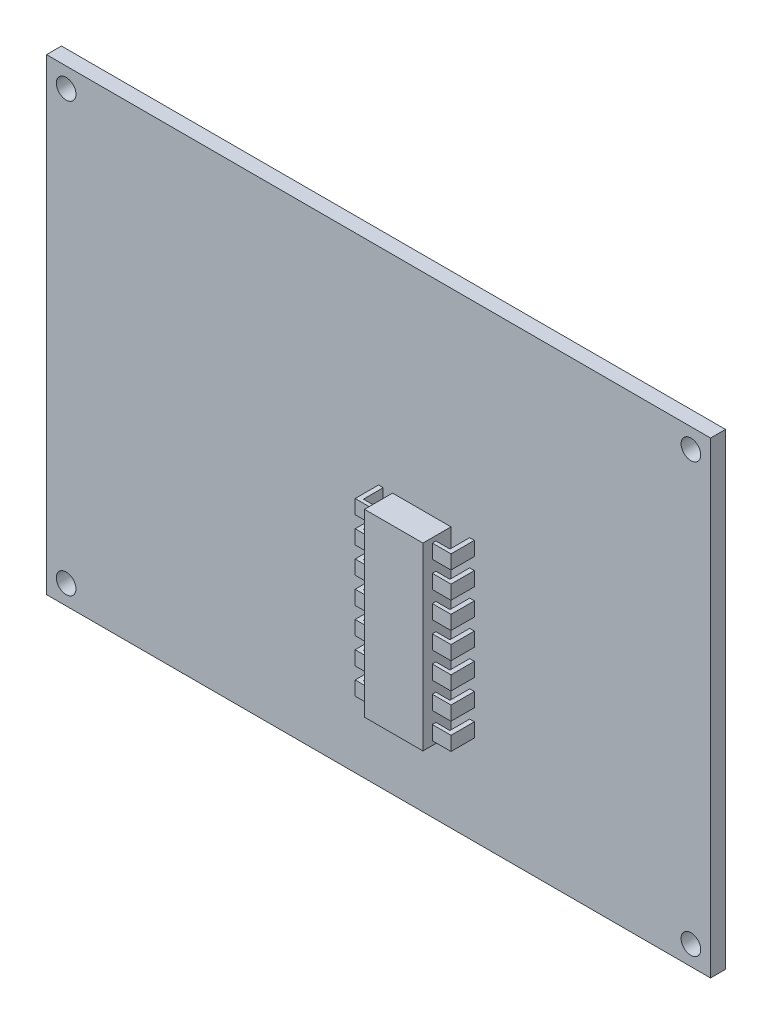
from build123d import *

# Parameters (mm, degrees)
SKETCH_1_W               = 71
SKETCH_1_H               = 50
SKETCH_1_R               = 1.05
EXTRUDE_1_DEPTH          = 1.6
SKETCH_2_W               = 6.25
SKETCH_2_H               = 19.25
EXTRUDE_2_DEPTH          = 3.5
EXTRUDE_START            = -1
SKETCH_4_W               = 2
SKETCH_4_H               = 1.5
EXTRUDE_3_DEPTH          = 2.5
CUT_EXTRUDE_1_DEPTH      = 83.071508455
CUT_EXTRUDE_1_DEPTH_BACK = 83.071508455


with BuildPart() as part:
    # Эскиз1 → Бобышка-Вытянуть1 (new body)
    with BuildSketch(Plane.XY):
        with Locations((35.5, 25)):
            Rectangle(SKETCH_1_W, SKETCH_1_H)
        with Locations((2.1, 47.9)):
            Circle(SKETCH_1_R, mode=Mode.SUBTRACT)
        with Locations(Location((68.9, 47.9, 0), (0, 0, 180))):
            Circle(SKETCH_1_R, mode=Mode.SUBTRACT)
        with Locations((68.9, 2.1)):
            Circle(SKETCH_1_R, mode=Mode.SUBTRACT)
        with Locations(Location((2.1, 2.1, 0), (0, 0, 180))):
            Circle(SKETCH_1_R, mode=Mode.SUBTRACT)
    extrude(amount=EXTRUDE_1_DEPTH)

    # Эскиз2 → Бобышка-Вытянуть2 (add)
    with BuildSketch(Plane.XY.offset(1.6)):
        with Locations((40.625, 18.775)):
            Rectangle(SKETCH_2_W, SKETCH_2_H)
    extrude(amount=EXTRUDE_2_DEPTH)

    # Эскиз4 → Бобышка-Вытянуть3 (add)
    with BuildSketch(Plane.XY.offset(5.1).offset(EXTRUDE_START)):
        with Locations((36.5, 27.15)):
            Rectangle(SKETCH_4_W, SKETCH_4_H)
        with Locations((44.75, 27.15)):
            Rectangle(SKETCH_4_W, SKETCH_4_H)
        with Locations((44.75, 24.35)):
            Rectangle(SKETCH_4_W, SKETCH_4_H)
        with Locations((44.75, 21.55)):
            Rectangle(SKETCH_4_W, SKETCH_4_H)
        with Locations((44.75, 18.75)):
            Rectangle(SKETCH_4_W, SKETCH_4_H)
        with Locations((44.75, 15.95)):
            Rectangle(SKETCH_4_W, SKETCH_4_H)
        with Locations((44.75, 13.15)):
            Rectangle(SKETCH_4_W, SKETCH_4_H)
        with Locations((44.75, 10.35)):
            Rectangle(SKETCH_4_W, SKETCH_4_H)
        with Locations((36.5, 24.35)):
            Rectangle(SKETCH_4_W, SKETCH_4_H)
        with Locations((36.5, 21.55)):
            Rectangle(SKETCH_4_W, SKETCH_4_H)
        with Locations((36.5, 18.75)):
            Rectangle(SKETCH_4_W, SKETCH_4_H)
        with Locations((36.5, 15.95)):
            Rectangle(SKETCH_4_W, SKETCH_4_H)
        with Locations((36.5, 13.15)):
            Rectangle(SKETCH_4_W, SKETCH_4_H)
        with Locations((36.5, 10.35)):
            Rectangle(SKETCH_4_W, SKETCH_4_H)
    extrude(amount=-EXTRUDE_3_DEPTH)

    # Эскиз5 → Вырез-Вытянуть1 (cut, two sides: drawn at the far end of the back side and taken through both)
    with BuildSketch(Plane.XZ.offset(-9.15).offset(-CUT_EXTRUDE_1_DEPTH_BACK)):
        Polygon((36, 1.6), (36, 3.716101485), (37.5, 3.716101485), (37.5, 2.1), (43.75, 2.1), (43.75, 3.716101485), (45.25, 3.716101485), (45.25, 1.6), align=None)
    extrude(amount=CUT_EXTRUDE_1_DEPTH + CUT_EXTRUDE_1_DEPTH_BACK, mode=Mode.SUBTRACT)


solid = part.part
